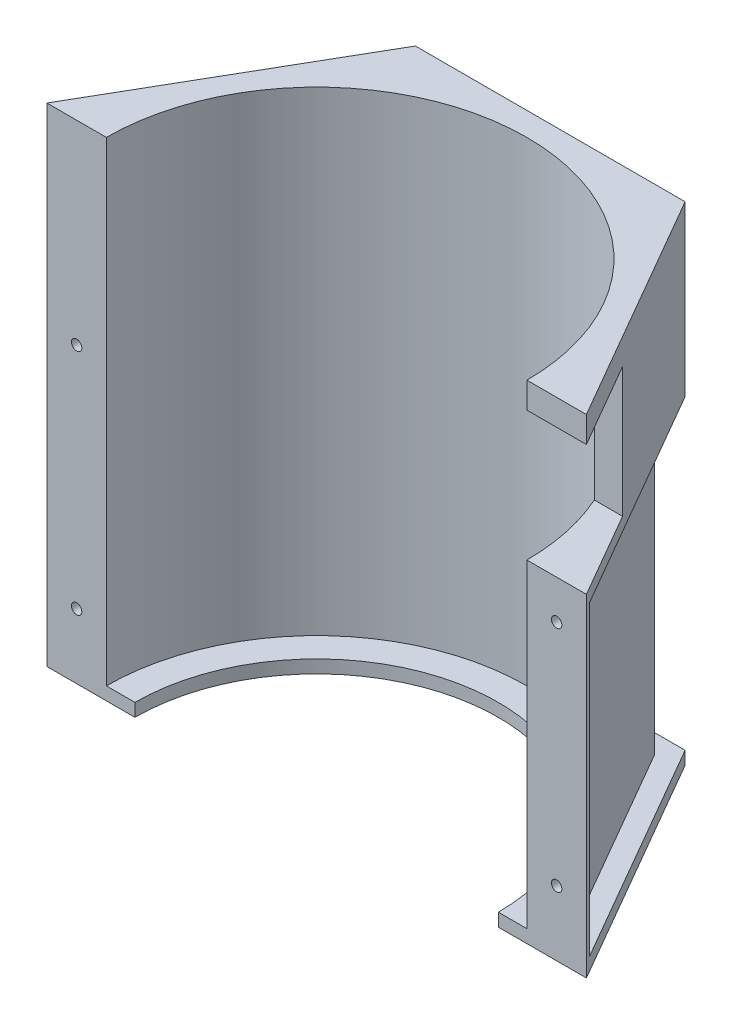
from build123d import *

# Parameters (mm, degrees)
BOSS_EXTRUDE1_DEPTH = 5
BOSS_EXTRUDE2_DEPTH = 118
BOSS_EXTRUDE3_DEPTH = 5
BOSS_EXTRUDE4_DEPTH = 50
BOSS_EXTRUDE5_DEPTH = 10
SKETCH6_R           = 2
CUT_EXTRUDE1_DEPTH  = 10
SKETCH7_R           = 2
CUT_EXTRUDE2_DEPTH  = 10


with BuildPart() as part:
    # Sketch1 → Boss-Extrude1 (new body)
    with BuildSketch(Plane(origin=(0, 0, 0), x_dir=(1, 0, 0), z_dir=(0, 1, 0))):
        with BuildLine():
            Line((-103.923048454, 0), (-70, 0))
            ThreePointArc((-70, 0), (0, 70), (70, 0))
            Line((70, 0), (103.923048454, 0))
            Line((103.923048454, 0), (51.961524227, 90))
            Line((51.961524227, 90), (-51.961524227, 90))
            Line((-51.961524227, 90), (-103.923048454, 0))
        make_face()
    extrude(amount=BOSS_EXTRUDE1_DEPTH)

    # Sketch2 → Boss-Extrude2 (add)
    with BuildSketch(Plane(origin=(0, 5, 0), x_dir=(1, 0, 0), z_dir=(0, 1, 0))):
        with BuildLine():
            Line((-95.262794416, 0), (-81, 0))
            ThreePointArc((-81, 0), (0, 81), (81, 0))
            Line((81, 0), (95.262794416, 0))
            Line((95.262794416, 0), (103.923048454, 0))
            Line((103.923048454, 0), (102.190997647, 3))
            Line((102.190997647, 3), (93.530743609, 3))
            Line((93.530743609, 3), (47.631397208, 82.5))
            Line((47.631397208, 82.5), (-47.631397208, 82.5))
            Line((-47.631397208, 82.5), (-93.530743609, 3))
            Line((-93.530743609, 3), (-102.190997647, 3))
            Line((-102.190997647, 3), (-103.923048454, 0))
            Line((-103.923048454, 0), (-95.262794416, 0))
        make_face()
    extrude(amount=BOSS_EXTRUDE2_DEPTH)

    # Sketch3 → Boss-Extrude3 (add)
    with BuildSketch(Plane(origin=(0, 123, 0), x_dir=(1, 0, 0), z_dir=(0, 1, 0))):
        with BuildLine():
            Line((-103.923048454, 0), (-81, 0))
            ThreePointArc((-81, 0), (0, 81), (81, 0))
            Line((81, 0), (103.923048454, 0))
            Line((103.923048454, 0), (51.961524227, 90))
            Line((51.961524227, 90), (-51.961524227, 90))
            Line((-51.961524227, 90), (-103.923048454, 0))
        make_face()
    extrude(amount=BOSS_EXTRUDE3_DEPTH)

    # Sketch4 → Boss-Extrude4 (add)
    with BuildSketch(Plane(origin=(0, 128, 0), x_dir=(1, 0, 0), z_dir=(0, 1, 0))):
        with BuildLine():
            Line((84.870489571, 33), (73.972968036, 33))
            ThreePointArc((73.972968036, 33), (-16.869937598, 79.22376667), (-81, 0))
            Line((-81, 0), (-103.923048454, 0))
            Line((-103.923048454, 0), (-51.961524227, 90))
            Line((-51.961524227, 90), (51.961524227, 90))
            Line((51.961524227, 90), (84.870489571, 33))
        make_face()
    extrude(amount=BOSS_EXTRUDE4_DEPTH)

    # Sketch5 → Boss-Extrude5 (add)
    with BuildSketch(Plane(origin=(0, 178, 0), x_dir=(1, 0, 0), z_dir=(0, 1, 0))):
        with BuildLine():
            Line((-103.923048454, 0), (-51.961524227, 90))
            Line((-51.961524227, 90), (51.961524227, 90))
            Line((51.961524227, 90), (103.923048454, 0))
            Line((103.923048454, 0), (81, 0))
            ThreePointArc((81, 0), (0, 81), (-81, 0))
            Line((-81, 0), (-103.923048454, 0))
        make_face()
    extrude(amount=BOSS_EXTRUDE5_DEPTH)

    # Sketch6 → Cut-Extrude1 (cut)
    with BuildSketch(Plane.XY):
        with Locations((92.461524227, 113)):
            Circle(SKETCH6_R)
        with Locations((92.461524227, 25)):
            Circle(SKETCH6_R)
        with Locations((-92.461524227, 25)):
            Circle(SKETCH6_R)
        with Locations((-92.461524227, 113)):
            Circle(SKETCH6_R)
    extrude(amount=-CUT_EXTRUDE1_DEPTH, mode=Mode.SUBTRACT)

    # Sketch7 → Cut-Extrude2 (cut)
    with BuildSketch(Plane.XZ):
        with Locations(Location((-30, -85, 0), (0, 0, 270))):
            Circle(SKETCH7_R)
        with Locations(Location((30, -85, 0), (0, 0, 270))):
            Circle(SKETCH7_R)
    extrude(amount=-CUT_EXTRUDE2_DEPTH, mode=Mode.SUBTRACT)


solid = part.part
